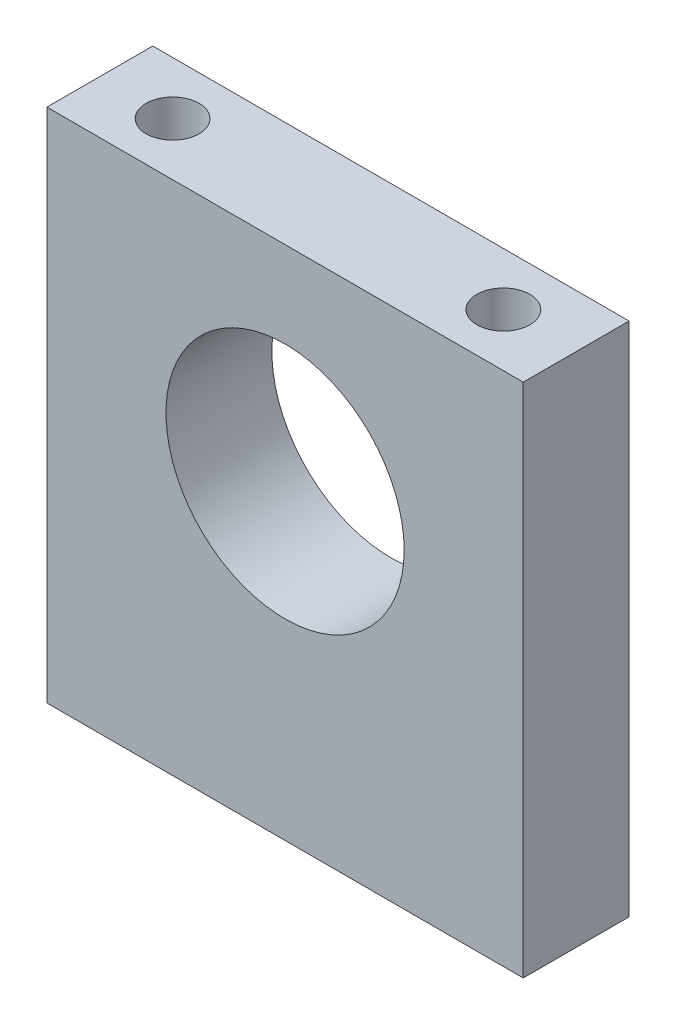
from build123d import *

# Parameters (mm, degrees)
SKETCH_1_W          = 36
SKETCH_1_H          = 8
SKETCH_1_R          = 2
EXTRUDE_1_DEPTH     = 39
SKETCH_3_R          = 9
CUT_EXTRUDE_1_DEPTH = 10


with BuildPart() as part:
    # 草图1 → 凸台-拉伸1 (new body)
    with BuildSketch(Plane(origin=(0, 0, 0), x_dir=(1, 0, 0), z_dir=(0, 1, 0))):
        Rectangle(SKETCH_1_W, SKETCH_1_H)
        with Locations(Location((12.5, 0, 0), (0, 0, 270))):
            Circle(SKETCH_1_R, mode=Mode.SUBTRACT)
        with Locations(Location((-12.5, 0, 0), (0, 0, 90))):
            Circle(SKETCH_1_R, mode=Mode.SUBTRACT)
    extrude(amount=EXTRUDE_1_DEPTH)

    # 草图3 → 切除-拉伸1 (cut)
    with BuildSketch(Plane.XY.offset(4)):
        with Locations((0, 23.5)):
            Circle(SKETCH_3_R)
    extrude(amount=-CUT_EXTRUDE_1_DEPTH, mode=Mode.SUBTRACT)


solid = part.part
